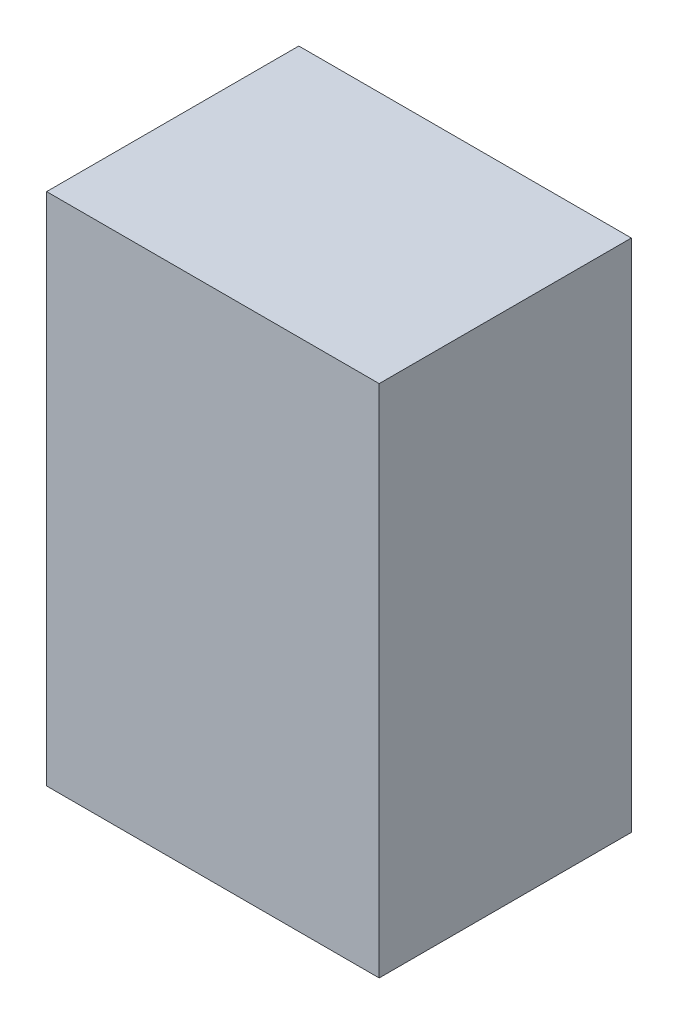
from build123d import *

# Parameters (mm, degrees)
SKETCH1_W           = 243.84
SKETCH1_H           = 377.444
BOSS_EXTRUDE1_DEPTH = 184.912


with BuildPart() as part:
    # Sketch1 → Boss-Extrude1 (new body)
    with BuildSketch(Plane.XY):
        Rectangle(SKETCH1_W, SKETCH1_H)
    extrude(amount=BOSS_EXTRUDE1_DEPTH)


solid = part.part
